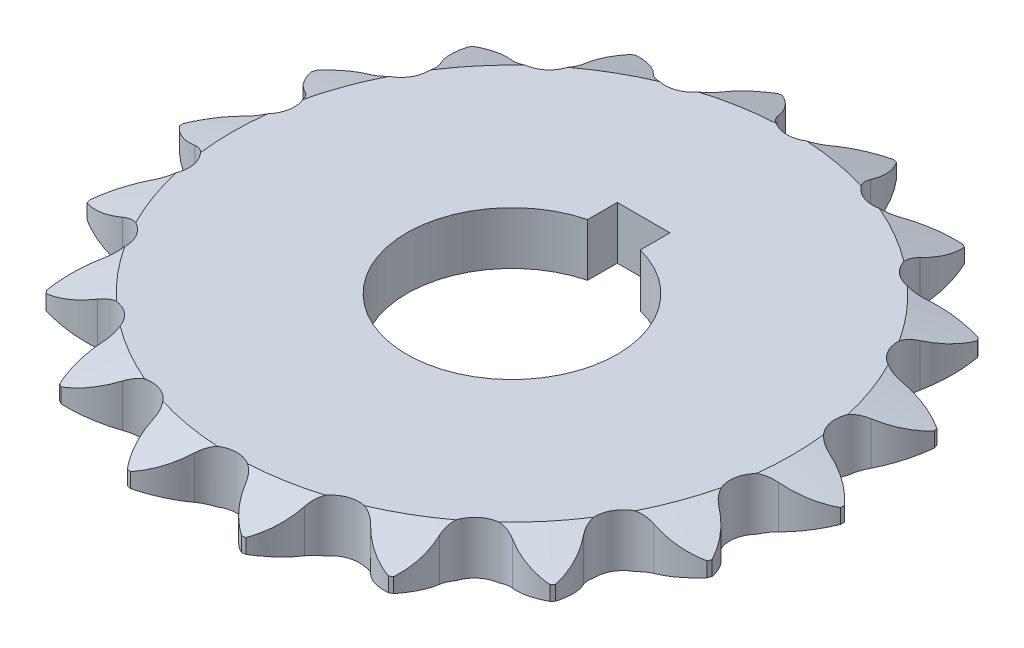
from build123d import *

# Parameters (mm, degrees)
SKETCH1_R                         = 19.939
BASE_CIRCLE_DEPTH                 = 1.5875
TOOTH_PROFILE_CUT_DEPTH           = 29.37618838
TOOTH_PROFILE_CUT_PATTERNS_COUNT  = 18
SHAFT_HOLE_WITH_KEYWAY_DEPTH      = 29.178133696
SHAFT_HOLE_WITH_KEYWAY_DEPTH_BACK = 29.178133696


with BuildPart() as part:
    # Sketch1 → Base Circle (new, symmetric)
    with BuildSketch(Plane(origin=(0, 0, 0), x_dir=(1, 0, 0), z_dir=(0, 1, 0))):
        with Locations(Location((0, 0, 0), (0, 0, 270))):
            Circle(SKETCH1_R)
    extrude(amount=BASE_CIRCLE_DEPTH, both=True)

    # Sketch2 → Tooth profile Cut (cut, symmetric)
    with BuildSketch(Plane(origin=(0, 1.5875, 0), x_dir=(1, 0, 0), z_dir=(0, 1, 0))):
        with BuildLine():
            ThreePointArc((3.346768135, 19.656115182), (0, 19.939), (-3.346768135, 19.656115182))
            ThreePointArc((-3.346768135, 19.656115182), (-2.293313218, 18.766463791), (-1.553063764, 17.603159185))
            ThreePointArc((-1.553063764, 17.603159185), (0, 16.590645), (1.553063764, 17.603159185))
            ThreePointArc((1.553063764, 17.603159185), (2.293313218, 18.766463791), (3.346768135, 19.656115182))
        make_face()
    tooth_profile_cut = extrude(amount=TOOTH_PROFILE_CUT_DEPTH, both=True, mode=Mode.SUBTRACT)

    # Tooth Profile Cut Patterns: Tooth profile Cut ×18 about axis
    tooth_profile_cut_patterns_axis = Axis((0, 0, 0), (0, 1, 0))
    for i in range(1, TOOTH_PROFILE_CUT_PATTERNS_COUNT):
        add(tooth_profile_cut.rotate(tooth_profile_cut_patterns_axis, i * 360 / TOOTH_PROFILE_CUT_PATTERNS_COUNT), mode=Mode.SUBTRACT)

    # Sketch3 → Tooth Chamfer (revolve, cut)
    with BuildSketch(Plane(origin=(0, 0, 0), x_dir=(0, 0, -1), z_dir=(1, 0, 0))):
        Polygon((20.056325374, -0.396875), (16.881325374, -1.5875), (20.056325374, -1.5875), align=None)
        Polygon((16.881325374, 1.5875), (20.056325374, 0.396875), (20.056325374, 1.5875), align=None)
    revolve(axis=Axis((0, 1.5875, 0), (0, -1, 0)), mode=Mode.SUBTRACT)

    # Sketch4 → Shaft hole with keyway (cut, two sides: drawn at the far end of the back side and taken through both)
    with BuildSketch(Plane.XZ.offset(1.5875).offset(-SHAFT_HOLE_WITH_KEYWAY_DEPTH_BACK)):
        with BuildLine():
            Line((0, -7.9375), (1.5875, -7.9375))
            Line((1.5875, -7.9375), (1.5875, -6.148361062))
            ThreePointArc((1.5875, -6.148361062), (0, 6.35), (-1.5875, -6.148361062))
            Line((-1.5875, -6.148361062), (-1.5875, -7.9375))
            Line((-1.5875, -7.9375), (0, -7.9375))
        make_face()
    extrude(amount=SHAFT_HOLE_WITH_KEYWAY_DEPTH + SHAFT_HOLE_WITH_KEYWAY_DEPTH_BACK, mode=Mode.SUBTRACT)


solid = part.part
